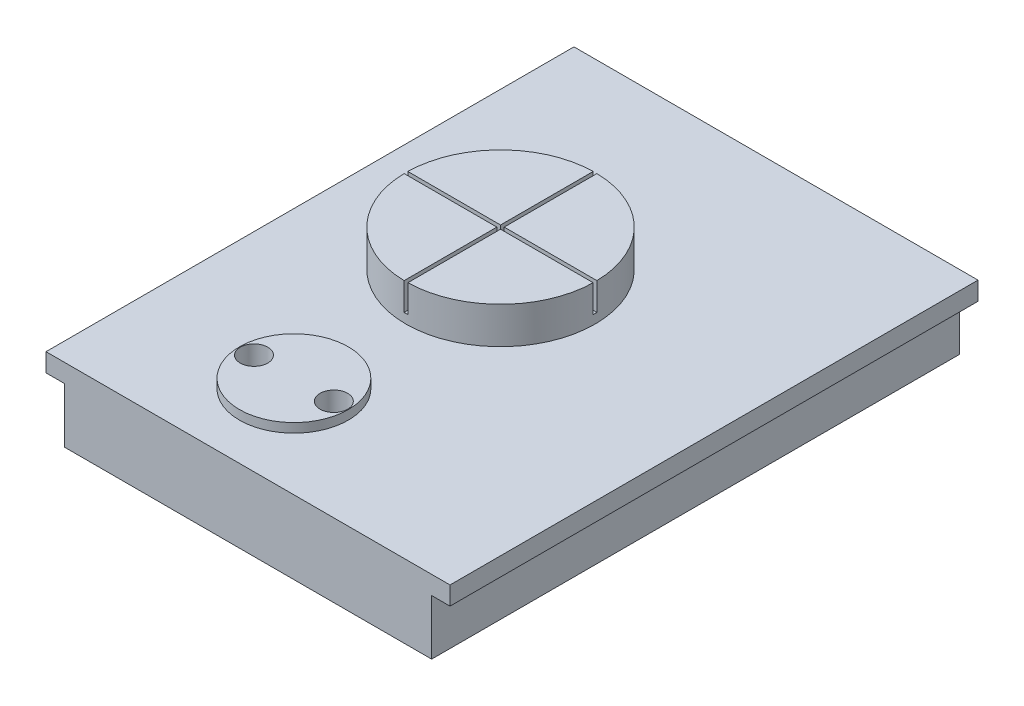
from build123d import *

# Parameters (mm, degrees)
SKETCH1_W               = 40
SKETCH1_H               = 57.5
SKETCH1_R               = 1.5
BOSS_EXTRUDE1_DEPTH     = 8
SKETCH1_3_W             = 2
SKETCH1_3_H             = 57.5
BOSS_EXTRUDE2_DEPTH     = 2
SKETCH1_4_R             = 10.3
BOSS_EXTRUDE3_DEPTH     = 4
BOSS_EXTRUDE4_START     = 1
SKETCH1_5_R             = 5.925
SKETCH1_5_R_2           = 1.5
BOSS_EXTRUDE4_DEPTH     = 1
CUT_EXTRUDE1_START      = -6
SKETCH2_R               = 1.9
SKETCH2_R_2             = 1.5
CUT_EXTRUDE1_DEPTH      = 6
SKETCH3_W               = 0.4
SKETCH3_H               = 20.6
SKETCH3_W_2             = 20.6
SKETCH3_H_2             = 0.4
CUT_EXTRUDE_THIN1_DEPTH = 3


with BuildPart() as part:
    # Sketch1 → Boss-Extrude1 (new body)
    with BuildSketch(Plane(origin=(0, 0, 0), x_dir=(1, 0, 0), z_dir=(0, 1, 0))):
        with Locations((5, 18.75)):
            Rectangle(SKETCH1_W, SKETCH1_H)
        with Locations((4.35, 0)):
            Circle(SKETCH1_R, mode=Mode.SUBTRACT)
        with Locations((-4.35, 0)):
            Circle(SKETCH1_R, mode=Mode.SUBTRACT)
    extrude(amount=-BOSS_EXTRUDE1_DEPTH)

    # Sketch1<3> → Boss-Extrude2 (add)
    with BuildSketch(Plane(origin=(0, 0, 0), x_dir=(1, 0, 0), z_dir=(0, 1, 0))):
        with Locations((-16, 18.75)):
            Rectangle(SKETCH1_3_W, SKETCH1_3_H)
        with Locations((26, 18.75)):
            Rectangle(SKETCH1_3_W, SKETCH1_3_H)
    extrude(amount=-BOSS_EXTRUDE2_DEPTH)

    # Sketch1<4> → Boss-Extrude3 (add)
    with BuildSketch(Plane(origin=(0, 0, 0), x_dir=(1, 0, 0), z_dir=(0, 1, 0))):
        with Locations((0, 22.5)):
            Circle(SKETCH1_4_R)
    extrude(amount=BOSS_EXTRUDE3_DEPTH)

    # Sketch1<5> → Boss-Extrude4 (add)
    with BuildSketch(Plane(origin=(0, 0, 0), x_dir=(1, 0, 0), z_dir=(0, 1, 0)).offset(BOSS_EXTRUDE4_START)):
        Circle(SKETCH1_5_R)
        with Locations((-4.35, 0)):
            Circle(SKETCH1_5_R_2, mode=Mode.SUBTRACT)
        with Locations((4.35, 0)):
            Circle(SKETCH1_5_R_2, mode=Mode.SUBTRACT)
    extrude(amount=-BOSS_EXTRUDE4_DEPTH)

    # Sketch2 → Cut-Extrude1 (cut)
    # profile 1 of 2: a face of its own
    with BuildSketch(Plane.XZ.offset(8).offset(CUT_EXTRUDE1_START)):
        with Locations((-4.35, 0)):
            Circle(SKETCH2_R)
        with Locations((-4.35, 0)):
            Circle(SKETCH2_R_2, mode=Mode.SUBTRACT)
    # profile 2 of 2: a face of its own
    with BuildSketch(Plane.XZ.offset(8).offset(CUT_EXTRUDE1_START)):
        with Locations((4.35, 0)):
            Circle(SKETCH2_R)
        with Locations((4.35, 0)):
            Circle(SKETCH2_R_2, mode=Mode.SUBTRACT)
    extrude(amount=CUT_EXTRUDE1_DEPTH, mode=Mode.SUBTRACT)

    # Sketch3 → Cut-Extrude-Thin1 (cut)
    with BuildSketch(Plane(origin=(0, 4, 0), x_dir=(1, 0, 0), z_dir=(0, 1, 0))):
        with Locations((0, 22.5)):
            Rectangle(SKETCH3_W, SKETCH3_H)
        with Locations((0, 22.5)):
            Rectangle(SKETCH3_W_2, SKETCH3_H_2)
    extrude(amount=-CUT_EXTRUDE_THIN1_DEPTH, mode=Mode.SUBTRACT)


solid = part.part
